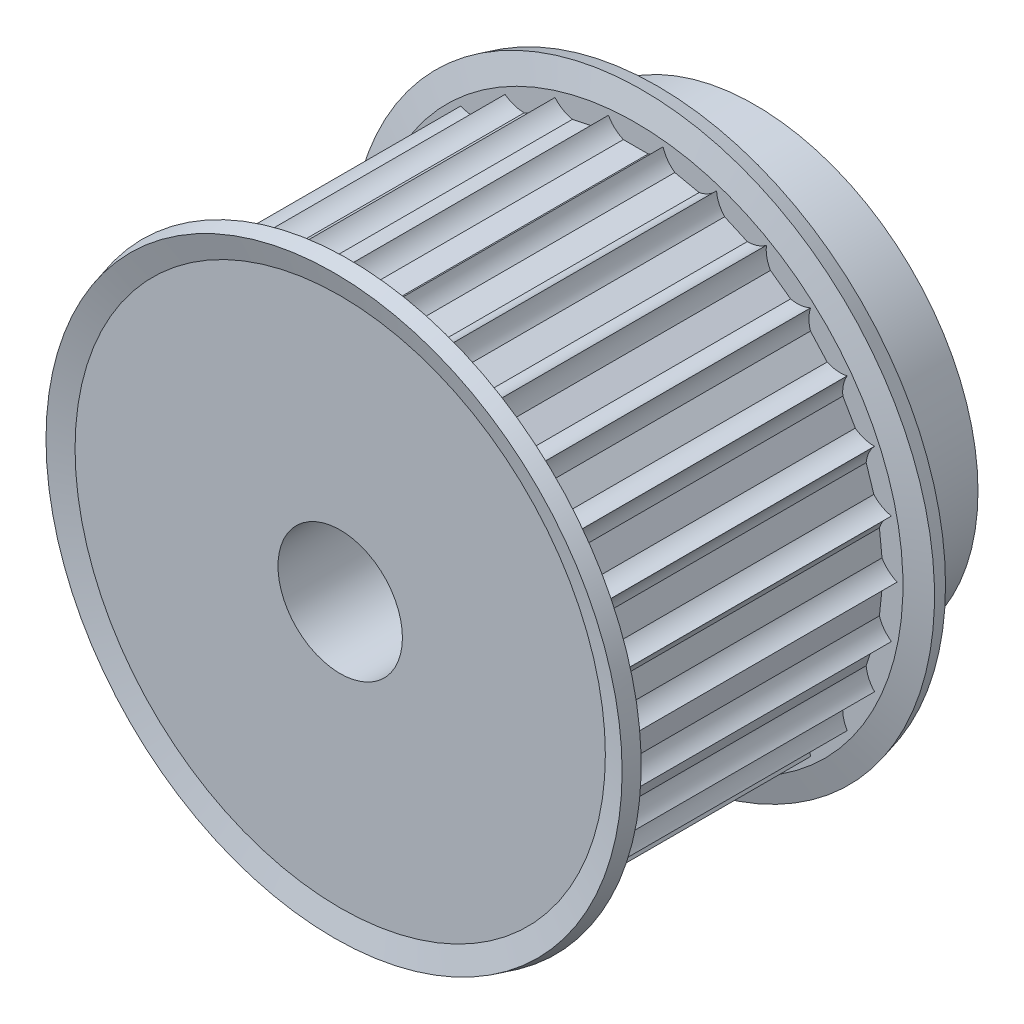
from build123d import *

# Parameters (mm, degrees)
CUT_EXTRUDE1_DEPTH = 35
CIRPATTERN1_COUNT  = 30
SKETCH4_W          = 1.5
SKETCH4_H          = 1.584495562


with BuildPart() as part:
    # Sketch1 → Revolve1 (revolve)
    with BuildSketch(Plane(origin=(0, 0, 0), x_dir=(0, 0, -1), z_dir=(1, 0, 0)), mode=Mode.PRIVATE) as revolve1_sk:
        Polygon((0, 6), (40, 6), (40, 21.5), (30, 21.5), (30, 27.25), (0, 27.25), align=None)
    revolve(revolve1_sk.sketch.rotate(Axis((0, 0, 0), (0, 0, -1)), 90), axis=Axis((0, 0, 0), (0, 0, -1)))

    # Sketch2 → Cut-Extrude1 (cut)
    with BuildSketch(Plane.XY):
        with BuildLine():
            Line((3.75, 26.5), (3.674234614, 26.5))
            ThreePointArc((3.674234614, 26.5), (3.199892965, 26.330947502), (2.939387691, 25.9))
            ThreePointArc((2.939387691, 25.9), (2.331759211, 24.612435701), (1.198957881, 23.75))
            Line((1.198957881, 23.75), (-1.198957881, 23.75))
            ThreePointArc((-1.198957881, 23.75), (-2.331759211, 24.612435701), (-2.939387691, 25.9))
            ThreePointArc((-2.939387691, 25.9), (-3.199892965, 26.330947502), (-3.674234614, 26.5))
            Line((-3.674234614, 26.5), (-3.75, 26.5))
            Line((-3.75, 26.5), (-3.75, 28.5))
            Line((-3.75, 28.5), (3.75, 28.5))
            Line((3.75, 28.5), (3.75, 26.5))
        make_face()
    cut_extrude1 = extrude(amount=-CUT_EXTRUDE1_DEPTH, mode=Mode.SUBTRACT)

    # CirPattern1: Cut-Extrude1 ×30 about axis
    cirpattern1_axis = Axis((0, 0, 0), (0, 0, 1))
    for i in range(1, CIRPATTERN1_COUNT):
        add(cut_extrude1.rotate(cirpattern1_axis, i * 360 / CIRPATTERN1_COUNT), mode=Mode.SUBTRACT)

    # Sketch4 → Revolve3 (revolve)
    with BuildSketch(Plane(origin=(0, 0, 0), x_dir=(0, 0, -1), z_dir=(1, 0, 0)), mode=Mode.PRIVATE) as revolve3_sk:
        Polygon((28.5, 25.76477844), (28.5, 25.06477844), (30, 25.06477844), (30, 25.567299693), (29.948888739, 25.376549872), align=None)
        Polygon((30, 25.76477844), (28.5, 25.76477844), (29.948888739, 25.376549872), (30, 25.567299693), align=None)
        Polygon((29.143078062, 28.16477844), (28.5, 25.76477844), (30, 25.76477844), (30, 25.567299693), (30.591966801, 27.776549872), align=None)
        with Locations((29.25, 24.272530659)):
            Rectangle(SKETCH4_W, SKETCH4_H)
        Polygon((0, 25.567299693), (0, 25.76477844), (1.5, 25.76477844), (0.856921938, 28.16477844), (-0.591966801, 27.776549872), align=None)
        Polygon((1.5, 25.06477844), (1.5, 25.76477844), (0.051111261, 25.376549872), (0, 25.567299693), (0, 25.06477844), align=None)
        Polygon((1.5, 25.76477844), (0, 25.76477844), (0, 25.567299693), (0.051111261, 25.376549872), align=None)
        with Locations((0.75, 24.272530659)):
            Rectangle(SKETCH4_W, SKETCH4_H)
    revolve(revolve3_sk.sketch.rotate(Axis((0, 0, 0), (0, 0, 1)), 90), axis=Axis((0, 0, 0), (0, 0, 1)))


solid = part.part
